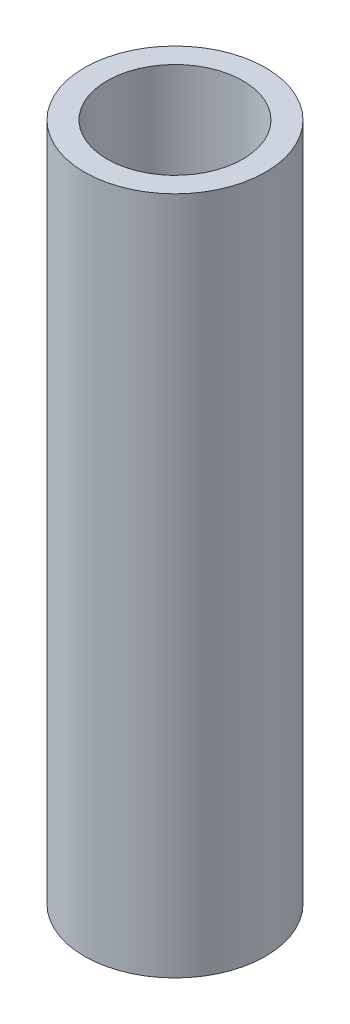
from build123d import *

# Parameters (mm, degrees)
SKETCH_1_R      = 4
SKETCH_1_R_2    = 3
EXTRUDE_1_DEPTH = 30


with BuildPart() as part:
    # 草图1 → 凸台-拉伸1 (new body)
    with BuildSketch(Plane(origin=(0, 0, 0), x_dir=(1, 0, 0), z_dir=(0, 1, 0))):
        with Locations(Location((0, 0, 0), (0, 0, 270))):
            Circle(SKETCH_1_R)
        with Locations(Location((0, 0, 0), (0, 0, 270))):
            Circle(SKETCH_1_R_2, mode=Mode.SUBTRACT)
    extrude(amount=EXTRUDE_1_DEPTH)


solid = part.part
